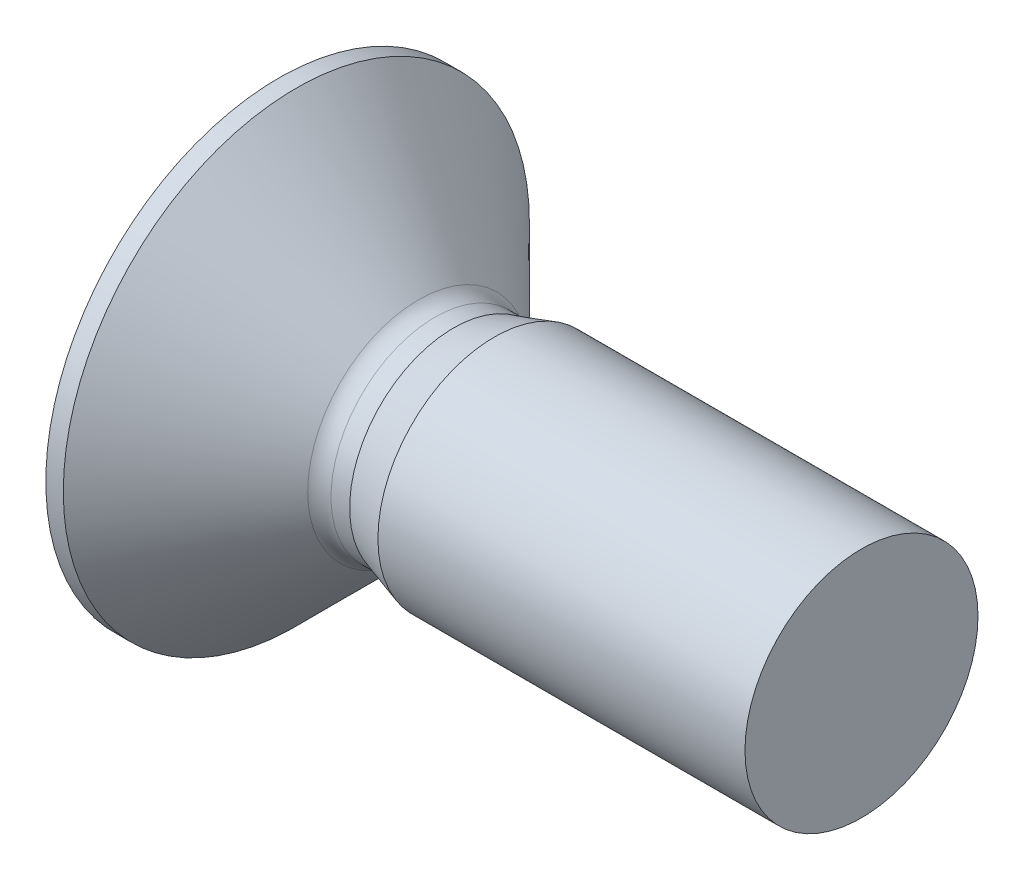
from build123d import *

# Parameters (mm, degrees)
CUT_EXTRUDE_1_DEPTH = 1.15
FILLET_1_R          = 0.4
FILLET_2_R          = 0.8


with BuildPart() as part:
    # 草圖1 → 旋轉1 (revolve)
    with BuildSketch(Plane.XY, mode=Mode.PRIVATE) as revolve_1_sk:
        Polygon((-2.3, 4), (-2.3, 0), (7.7, 0), (7.7, 2), (1.4, 2), (0.7, 1.78525), (0.21475, 1.78525), (-2, 4), align=None)
    revolve(revolve_1_sk.sketch.rotate(Axis((-2.3, 0, 0), (1, 0, 0)), 270), axis=Axis((-2.3, 0, 0), (1, 0, 0)))

    # 草圖2 → 除料-伸長1 (cut)
    with BuildSketch(Plane.ZY.offset(2.3)):
        Polygon((0.533333333, -0.533333333), (2.25, -0.533333333), (2.25, 0.533333333), (0.533333333, 0.533333333), (0.533333333, 2.25), (-0.533333333, 2.25), (-0.533333333, 0.533333333), (-2.25, 0.533333333), (-2.25, -0.533333333), (-0.533333333, -0.533333333), (-0.533333333, -2.25), (0.533333333, -2.25), align=None)
    extrude(amount=-CUT_EXTRUDE_1_DEPTH, mode=Mode.SUBTRACT)

    # 圓角1
    fillet_1_edges = [part.edges().sort_by_distance(p)[0] for p in [
        (0.21475, 0, 1.78525),
    ]]
    fillet(fillet_1_edges, radius=FILLET_1_R)

    # 圓角2
    fillet_2_edges = [part.edges().sort_by_distance(p)[0] for p in [
        (-1.725, -0.533333333, 0.533333333),
        (-1.725, -0.533333333, -0.533333333),
        (-1.725, 0.533333333, -0.533333333),
        (-1.725, 0.533333333, 0.533333333),
    ]]
    fillet(fillet_2_edges, radius=FILLET_2_R)


solid = part.part
